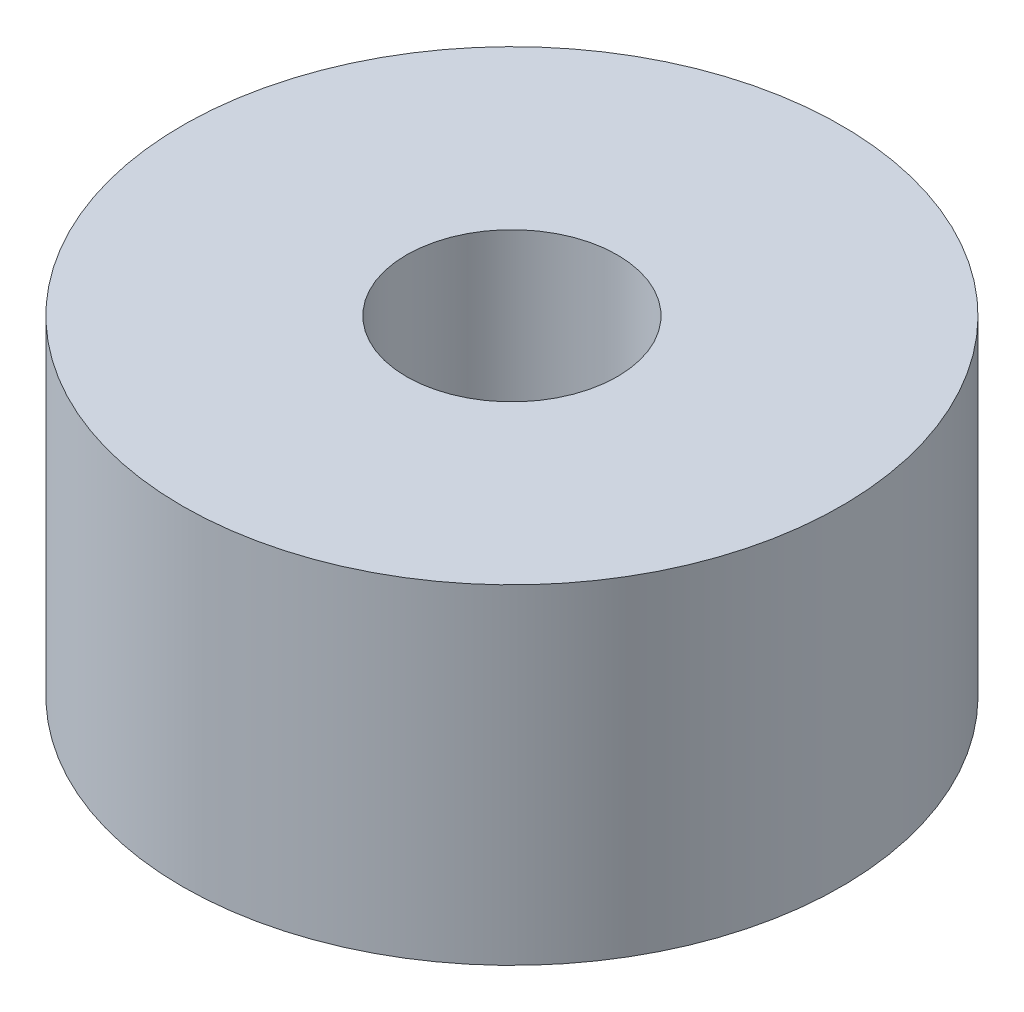
from build123d import *

# Parameters (mm, degrees)
SKETCH_1_R      = 5
SKETCH_1_R_2    = 1.6
EXTRUDE_1_DEPTH = 5


with BuildPart() as part:
    # ｽｹｯﾁ1 → ﾎﾞｽ - 押し出し1 (new body)
    with BuildSketch(Plane(origin=(0, 0, 0), x_dir=(1, 0, 0), z_dir=(0, 1, 0))):
        with Locations(Location((0, 0, 0), (0, 0, 270))):
            Circle(SKETCH_1_R)
        with Locations(Location((0, 0, 0), (0, 0, 270))):
            Circle(SKETCH_1_R_2, mode=Mode.SUBTRACT)
    extrude(amount=EXTRUDE_1_DEPTH)


solid = part.part
